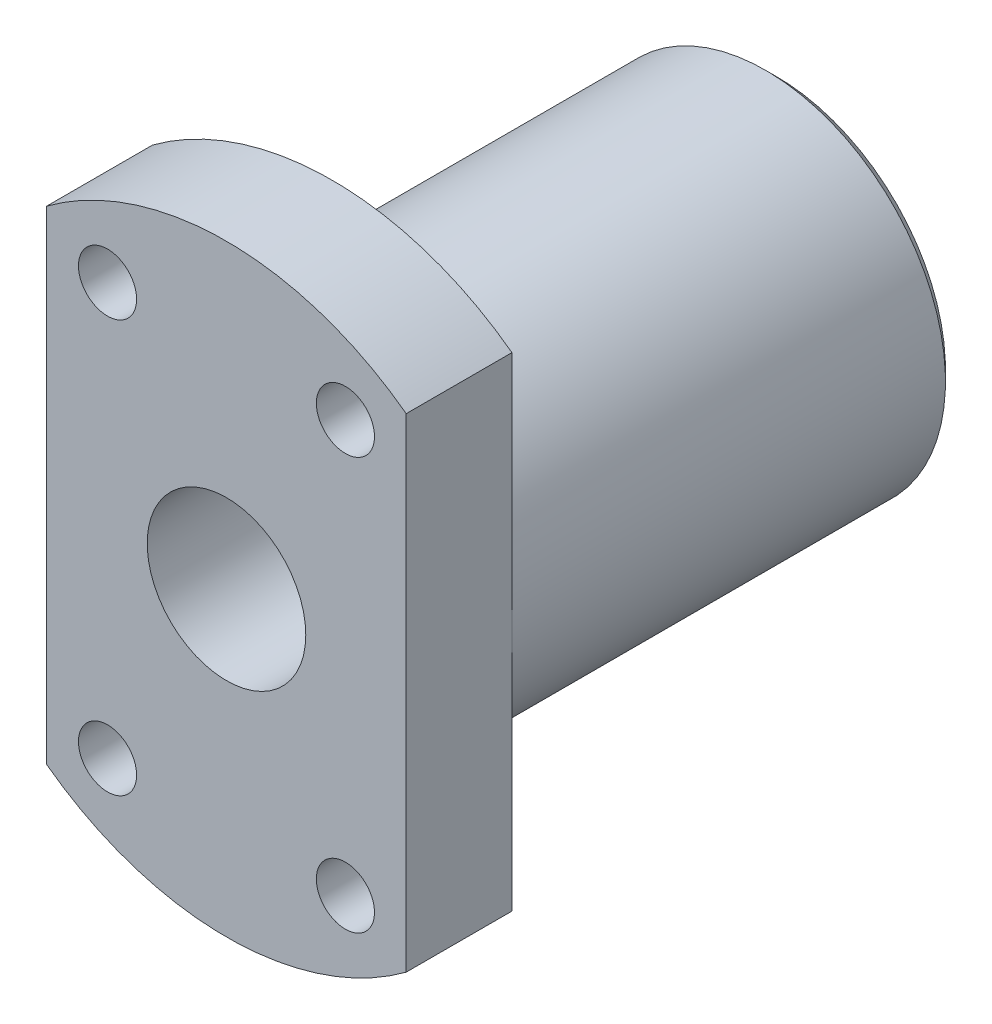
from build123d import *

# Parameters (mm, degrees)
SKETCH_1_R          = 28.5
EXTRUDE_1_DEPTH     = 10
SKETCH_2_W          = 42.780685773
SKETCH_2_H          = 76.581039372
CUT_EXTRUDE_1_DEPTH = 42.527099586
SKETCH_3_R          = 17
EXTRUDE_2_DEPTH     = 42
SKETCH_4_R          = 2.75
CUT_EXTRUDE_2_DEPTH = 42
SKETCH_5_R          = 7.5
CUT_EXTRUDE_3_DEPTH = 62.686708455
CHAMFER_1_SIZE      = 1


with BuildPart() as part:
    # 草图1 → 凸台-拉伸1 (new body)
    with BuildSketch(Plane.XY):
        Circle(SKETCH_1_R)
    extrude(amount=EXTRUDE_1_DEPTH)

    # 草图2 → 切除-拉伸1 (cut, through all)
    with BuildSketch(Plane.XY.offset(10)):
        with Locations((-38.390342887, -1.01716671)):
            Rectangle(SKETCH_2_W, SKETCH_2_H)
        with Locations((38.390342887, -1.01716671)):
            Rectangle(SKETCH_2_W, SKETCH_2_H)
    extrude(amount=-CUT_EXTRUDE_1_DEPTH, mode=Mode.SUBTRACT)

    # 草图3 → 凸台-拉伸2 (add)
    with BuildSketch(Plane(origin=(0, 0, 0), x_dir=(-1, 0, 0), z_dir=(0, 0, -1))):
        Circle(SKETCH_3_R)
    extrude(amount=EXTRUDE_2_DEPTH)

    # 草图4 → 切除-拉伸2 (cut)
    with BuildSketch(Plane(origin=(0, 0, 0), x_dir=(-1, 0, 0), z_dir=(0, 0, -1))):
        with Locations((-11.25, 19.485571585)):
            Circle(SKETCH_4_R)
        with Locations((11.25, 19.485571585)):
            Circle(SKETCH_4_R)
        with Locations((11.25, -19.485571585)):
            Circle(SKETCH_4_R)
        with Locations((-11.25, -19.485571585)):
            Circle(SKETCH_4_R)
    extrude(amount=-CUT_EXTRUDE_2_DEPTH, mode=Mode.SUBTRACT)

    # 草图5 → 切除-拉伸3 (cut, through all)
    with BuildSketch(Plane.XY.offset(10)):
        Circle(SKETCH_5_R)
    extrude(amount=-CUT_EXTRUDE_3_DEPTH, mode=Mode.SUBTRACT)

    # 倒角1
    chamfer_1_edges = [part.edges().sort_by_distance(p)[0] for p in [
        (17, 0, -42),
    ]]
    chamfer(chamfer_1_edges, length=CHAMFER_1_SIZE)


solid = part.part
